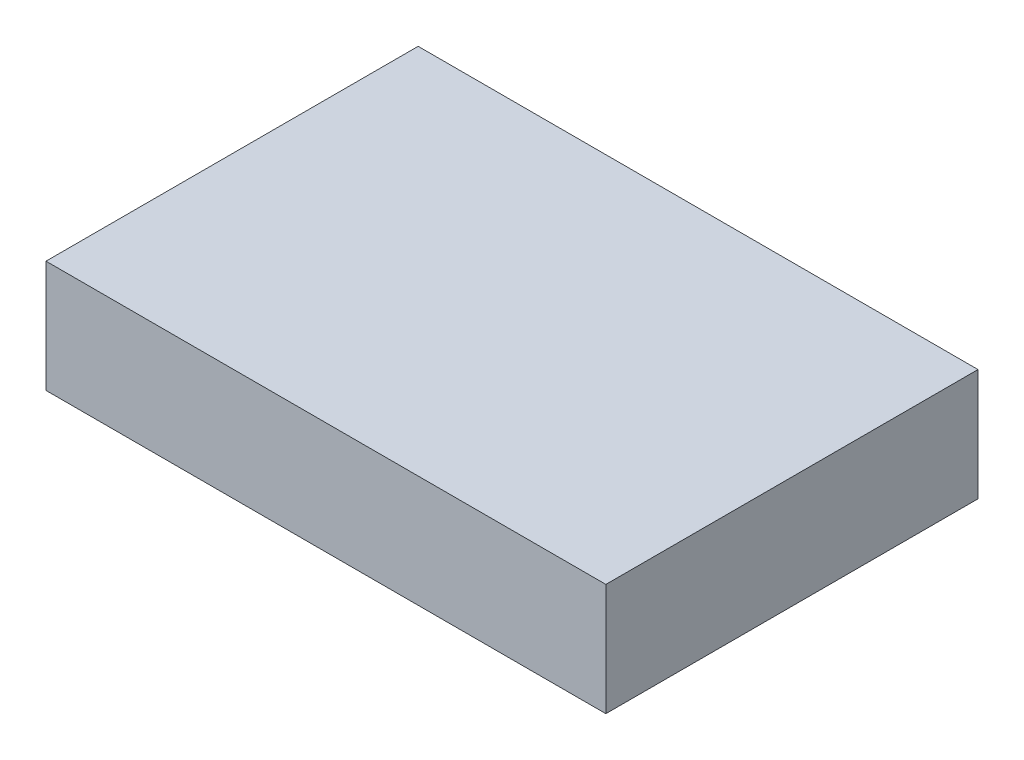
from build123d import *

# Parameters (mm, degrees)
SKETCH1_W           = 85
SKETCH1_H           = 56.5
BOSS_EXTRUDE1_DEPTH = 17


with BuildPart() as part:
    # Sketch1 → Boss-Extrude1 (new body)
    with BuildSketch(Plane(origin=(0, 0, 0), x_dir=(1, 0, 0), z_dir=(0, 1, 0))):
        with Locations((-42.5, -28.25)):
            Rectangle(SKETCH1_W, SKETCH1_H)
    extrude(amount=BOSS_EXTRUDE1_DEPTH)


solid = part.part
